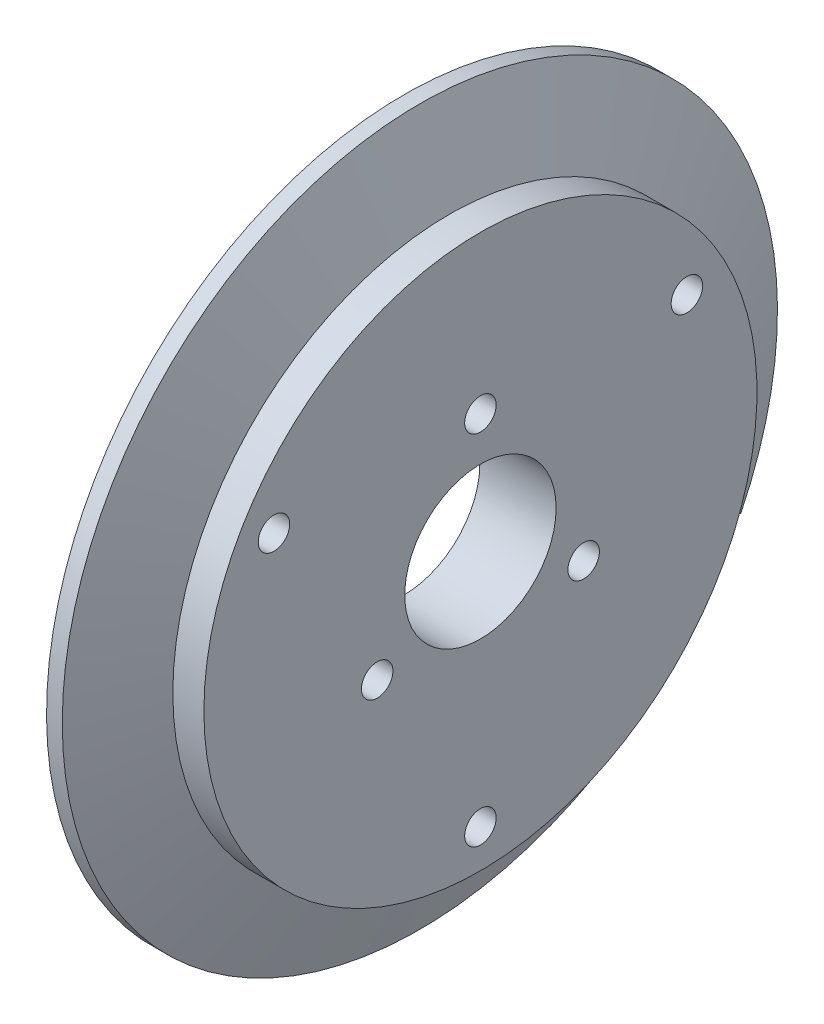
from build123d import *

# Parameters (mm, degrees)
SKETCH5_R          = 7.94
CUT_EXTRUDE1_DEPTH = 54.633012222
SKETCH7_R          = 1.65
CUT_EXTRUDE3_DEPTH = 54.633012222
SKETCH6_W          = 2
SKETCH6_H          = 5
CUT_EXTRUDE2_DEPTH = 65.4


with BuildPart() as part:
    # Sketch3 → Revolve1 (revolve)
    with BuildSketch(Plane.XY):
        Polygon((0, 0), (8, 0), (8, 29), (4.743746991, 29), (1.65, 37.5), (0, 37.5), align=None)
    revolve(axis=Axis((0, 0, 0), (1, 0, 0)))

    # Sketch5 → Cut-Extrude1 (cut, through all)
    with BuildSketch(Plane(origin=(0, 0, 0), x_dir=(0, 0, -1), z_dir=(1, 0, 0))):
        Circle(SKETCH5_R)
    extrude(amount=CUT_EXTRUDE1_DEPTH, mode=Mode.SUBTRACT)

    # Sketch7 → Cut-Extrude3 (cut, through all)
    with BuildSketch(Plane(origin=(8, 0, 0), x_dir=(0, 0, -1), z_dir=(1, 0, 0))):
        with Locations((0, 12.5)):
            Circle(SKETCH7_R)
        with Locations((-10.825317547, -6.25)):
            Circle(SKETCH7_R)
        with Locations((10.825317547, -6.25)):
            Circle(SKETCH7_R)
        with Locations((-21.650635095, 12.5)):
            Circle(SKETCH7_R)
        with Locations((21.650635095, 12.5)):
            Circle(SKETCH7_R)
        with Locations((0, -25)):
            Circle(SKETCH7_R)
    extrude(amount=-CUT_EXTRUDE3_DEPTH, mode=Mode.SUBTRACT)

    # Sketch6 → Cut-Extrude2 (cut)
    with BuildSketch(Plane(origin=(0, -38.5, -0.866025404), x_dir=(1, 0, 0), z_dir=(0, -0.499999999999998, -0.8660254037844398))):
        with Locations((1, -32.908965344)):
            Rectangle(SKETCH6_W, SKETCH6_H)
    extrude(amount=CUT_EXTRUDE2_DEPTH, mode=Mode.SUBTRACT)


solid = part.part
